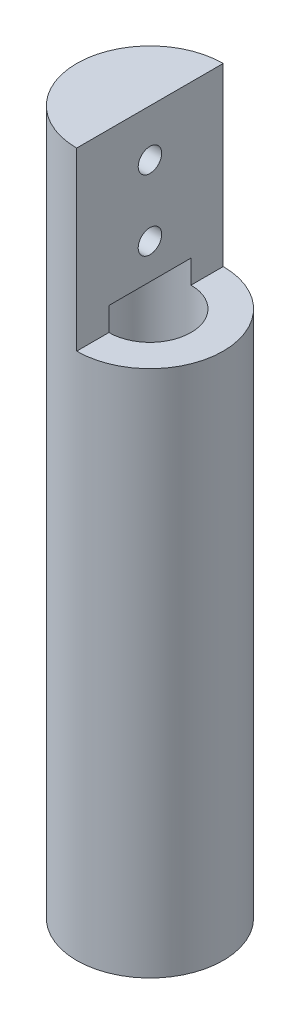
from build123d import *

# Parameters (mm, degrees)
SKETCH1_R           = 6.25
BOSS_EXTRUDE1_DEPTH = 60
CUT_EXTRUDE2_START  = -15
CUT_EXTRUDE2_DEPTH  = 15
SKETCH3_R           = 3.5
CUT_EXTRUDE3_DEPTH  = 46.85984082
CUT_EXTRUDE5_START  = -2
SKETCH7_R           = 3.5
CUT_EXTRUDE5_DEPTH  = 2
SKETCH8_R           = 1
CUT_EXTRUDE6_DEPTH  = 61.647547354
LPATTERN1_COUNT     = 2
LPATTERN1_PITCH     = 6
SKETCH9_R           = 0.75
CUT_EXTRUDE7_DEPTH  = 5
CIRPATTERN1_COUNT   = 2


with BuildPart() as part:
    # Sketch1 → Boss-Extrude1 (new body)
    with BuildSketch(Plane(origin=(0, 0, 0), x_dir=(1, 0, 0), z_dir=(0, 1, 0))):
        with Locations(Location((0, 0, 0), (0, 0, 270))):
            Circle(SKETCH1_R)
    extrude(amount=BOSS_EXTRUDE1_DEPTH)

    # Sketch2 → Cut-Extrude2 (cut)
    with BuildSketch(Plane(origin=(0, 60, 0), x_dir=(1, 0, 0), z_dir=(0, 1, 0)).offset(CUT_EXTRUDE2_START)):
        with BuildLine():
            Line((0, 6.25), (0, -6.25))
            ThreePointArc((0, -6.25), (6.25, 0), (0, 6.25))
        make_face()
    extrude(amount=CUT_EXTRUDE2_DEPTH, mode=Mode.SUBTRACT)

    # Sketch3 → Cut-Extrude3 (cut, through all)
    with BuildSketch(Plane(origin=(0, 45, 0), x_dir=(1, 0, 0), z_dir=(0, 1, 0))):
        with Locations(Location((0, 0, 0), (0, 0, 270))):
            Circle(SKETCH3_R)
    extrude(amount=-CUT_EXTRUDE3_DEPTH, mode=Mode.SUBTRACT)

    # Sketch7 → Cut-Extrude5 (cut)
    with BuildSketch(Plane.XZ.offset(-45).offset(CUT_EXTRUDE5_START)):
        with Locations(Location((0, 0, 0), (0, 0, 90))):
            Circle(SKETCH7_R)
    extrude(amount=CUT_EXTRUDE5_DEPTH, mode=Mode.SUBTRACT)

    # Sketch8 → Cut-Extrude6 (cut, through all)
    with BuildSketch(Plane(origin=(0, 0, 0), x_dir=(0, 0, -1), z_dir=(1, 0, 0))):
        with Locations((0, 56)):
            Circle(SKETCH8_R)
    cut_extrude6 = extrude(amount=-CUT_EXTRUDE6_DEPTH, mode=Mode.SUBTRACT)

    # LPattern1: Cut-Extrude6 ×2
    with Locations(*[(0, -i * LPATTERN1_PITCH, 0) for i in range(1, LPATTERN1_COUNT)]):
        add(cut_extrude6, mode=Mode.SUBTRACT)

    # Sketch9 → Cut-Extrude7 (cut)
    with BuildSketch(Plane.XZ):
        with Locations(Location((-4.5, 0, 0), (0, 0, 270))):
            Circle(SKETCH9_R)
    cut_extrude7 = extrude(amount=-CUT_EXTRUDE7_DEPTH, mode=Mode.SUBTRACT)

    # CirPattern1: Cut-Extrude7 ×2 about axis
    cirpattern1_axis = Axis((0, 0, 0), (0, 1, 0))
    for i in range(1, CIRPATTERN1_COUNT):
        add(cut_extrude7.rotate(cirpattern1_axis, i * 360 / CIRPATTERN1_COUNT), mode=Mode.SUBTRACT)


solid = part.part
